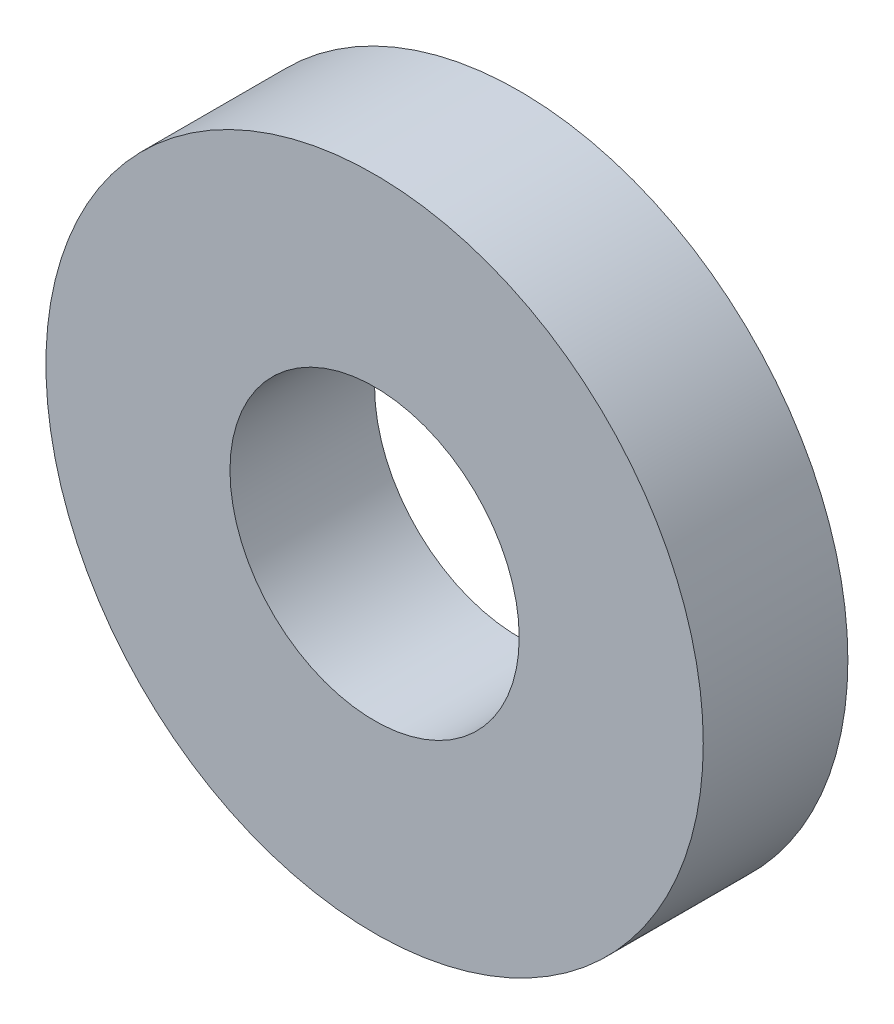
from build123d import *

# Parameters (mm, degrees)
SKETCH1_R           = 2.5
SKETCH1_R_2         = 1.1
BOSS_EXTRUDE1_DEPTH = 1.1


with BuildPart() as part:
    # Sketch1 → Boss-Extrude1 (new body)
    with BuildSketch(Plane.XY):
        Circle(SKETCH1_R)
        Circle(SKETCH1_R_2, mode=Mode.SUBTRACT)
    extrude(amount=BOSS_EXTRUDE1_DEPTH)


solid = part.part
